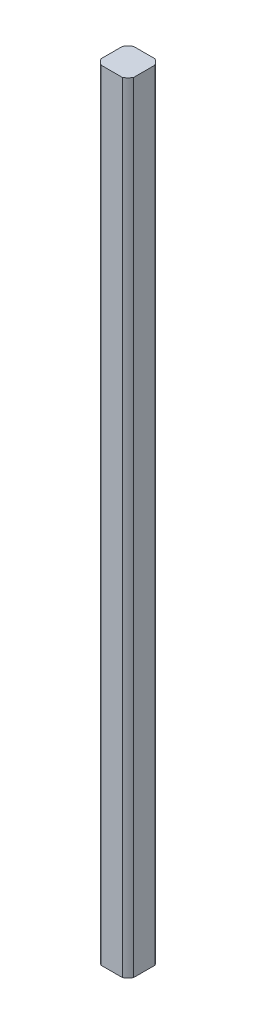
from build123d import *

# Parameters (mm, degrees)
BOSS_EXTRUDE1_DEPTH = 2400


with BuildPart() as part:
    # Sketch1 → Boss-Extrude1 (new body)
    with BuildSketch(Plane(origin=(0, 0, 0), x_dir=(1, 0, 0), z_dir=(0, 1, 0))):
        with BuildLine():
            Line((-33.166247904, 50), (33.166247904, 50))
            ThreePointArc((33.166247904, 50), (42.426406871, 42.426406871), (50, 33.166247904))
            Line((50, 33.166247904), (50, -33.166247904))
            ThreePointArc((50, -33.166247904), (42.426406871, -42.426406871), (33.166247904, -50))
            Line((33.166247904, -50), (-33.166247904, -50))
            ThreePointArc((-33.166247904, -50), (-42.426406871, -42.426406871), (-50, -33.166247904))
            Line((-50, -33.166247904), (-50, 33.166247904))
            ThreePointArc((-50, 33.166247904), (-42.426406871, 42.426406871), (-33.166247904, 50))
        make_face()
    extrude(amount=BOSS_EXTRUDE1_DEPTH)


solid = part.part
